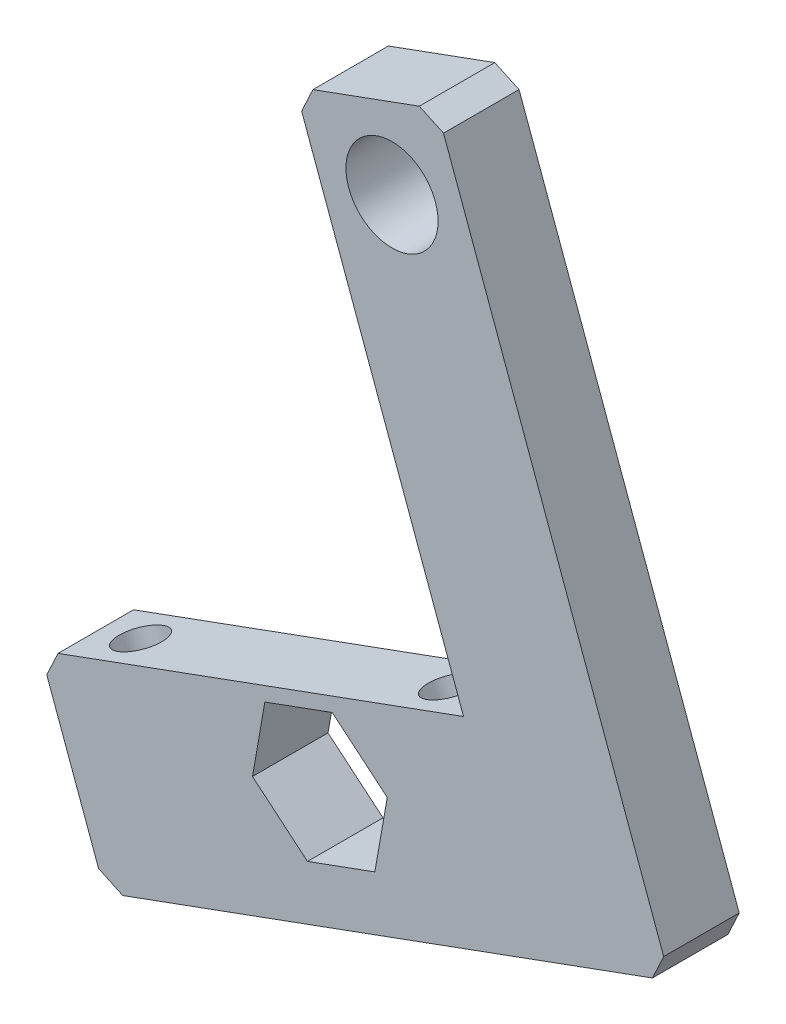
from build123d import *

# Parameters (mm, degrees)
SKETCH_1_R          = 6.1
EXTRUDE_1_DEPTH     = 10
SKETCH_2_R          = 3
CUT_EXTRUDE_2_DEPTH = 116.089044031
CHAMFER_1_SIZE      = 2.5
CUT_EXTRUDE_3_DEPTH = 131.445982376


with BuildPart() as part:
    # 草圖1 → 填料-伸長1 (new body)
    with BuildSketch(Plane.XY):
        Polygon((-29.956118011, 9.755168573), (-48.742646001, 2.894675435), (-26.446043305, -58.161540532), (-82.490240349, -78.627846462), (-73.914623927, -102.111006449), (0.916101107, -74.784207382), align=None)
        with Locations((-35.919135437, -3.068341991)):
            Circle(SKETCH_1_R, mode=Mode.SUBTRACT)
    extrude(amount=EXTRUDE_1_DEPTH)

    # 草圖2 → 除料-伸長2 (cut, through all)
    with BuildSketch(Plane(origin=(15.628555148, -42.796674065, 0), x_dir=(0.9393263994919209, 0.3430246568652819, 0), z_dir=(-0.3430246568652819, 0.939326399491921, 0))):
        with Locations(Location((-95.671540667, -4.982155923, 0), (0, 0, 180))):
            Circle(SKETCH_2_R)
        with Locations(Location((-52.126292594, -4.982155923, 0), (0, 0, 180))):
            Circle(SKETCH_2_R)
    extrude(amount=-CUT_EXTRUDE_2_DEPTH, mode=Mode.SUBTRACT)

    # 導角1
    chamfer_1_edges = [part.edges().sort_by_distance(p)[0] for p in [
        (0.916101107, -74.784207382, 5),
        (-73.914623927, -102.111006449, 5),
        (-82.490240349, -78.627846462, 5),
        (-48.742646001, 2.894675435, 5),
        (-29.956118011, 9.755168573, 5),
    ]]
    chamfer(chamfer_1_edges, length=CHAMFER_1_SIZE)

    # 草圖3 → 除料-伸長3 (cut, through all)
    with BuildSketch(Plane(origin=(0, 0, 0), x_dir=(-1, 0, 0), z_dir=(0, 0, -1))):
        Polygon((52.754237092, -69.656073014), (54.393890854, -79.013505116), (47.10994382, -85.112202978), (38.186343025, -81.853468738), (36.546689263, -72.496036636), (43.830636297, -66.397338774), align=None)
    extrude(amount=-CUT_EXTRUDE_3_DEPTH, mode=Mode.SUBTRACT)


solid = part.part
